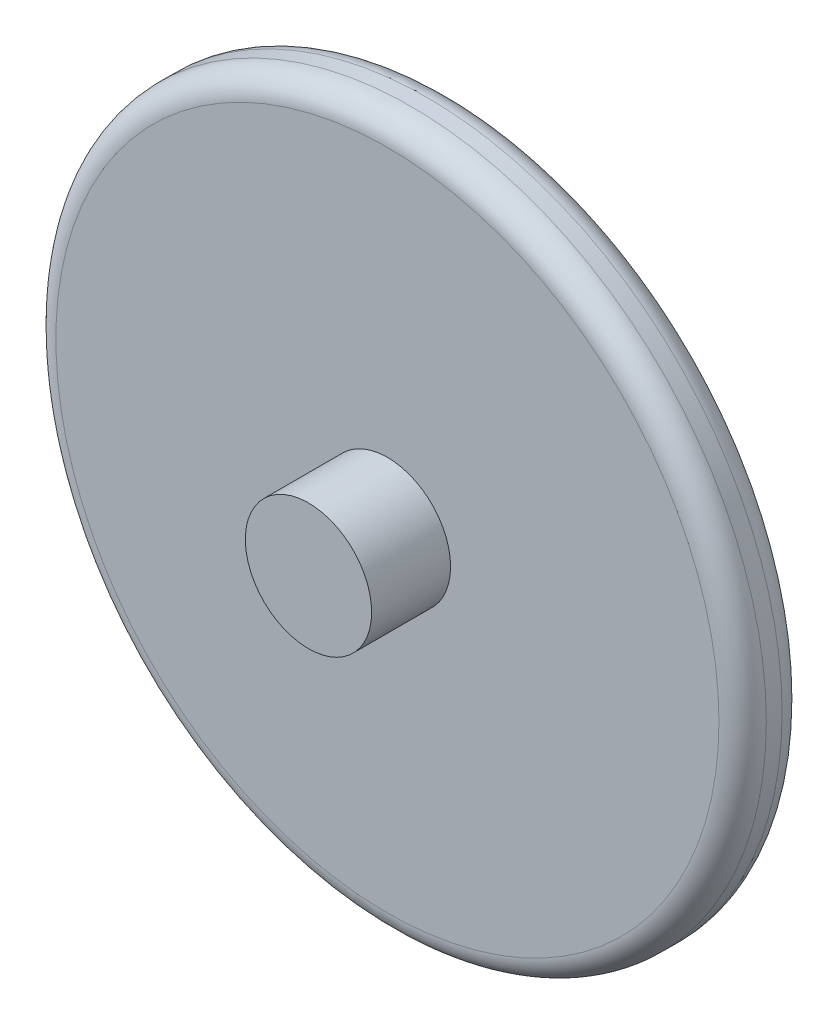
from build123d import *

# Parameters (mm, degrees)
CROQUIS1_R              = 45
SALIENTE_EXTRUIR1_DEPTH = 8
CROQUIS2_R              = 8
SALIENTE_EXTRUIR2_DEPTH = 10
REDONDEO1_R             = 3


with BuildPart() as part:
    # Croquis1 → Saliente-Extruir1 (new body)
    with BuildSketch(Plane.XY):
        Circle(CROQUIS1_R)
    extrude(amount=SALIENTE_EXTRUIR1_DEPTH)

    # Croquis2 → Saliente-Extruir2 (add)
    with BuildSketch(Plane.XY.offset(8)):
        Circle(CROQUIS2_R)
    extrude(amount=SALIENTE_EXTRUIR2_DEPTH)

    # Redondeo1
    redondeo1_edges = [part.edges().sort_by_distance(p)[0] for p in [
        (-45, 0, 0),
        (-45, 0, 8),
    ]]
    fillet(redondeo1_edges, radius=REDONDEO1_R)


solid = part.part
